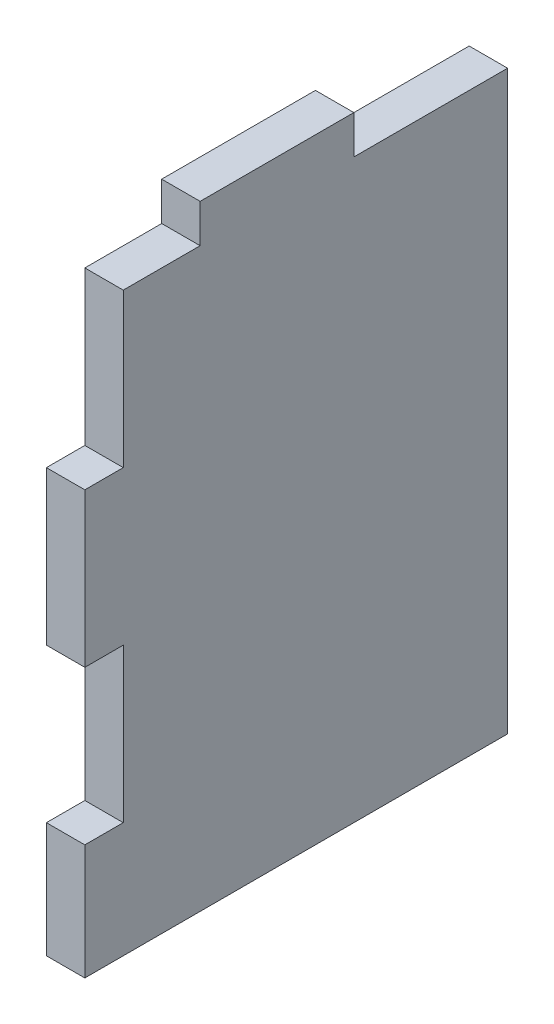
from build123d import *

# Parameters (mm, degrees)
SKETCH1_W           = 31.75
SKETCH1_H           = 47.625
SKETCH1_W_2         = 12.7
SKETCH1_H_2         = 3.175
SKETCH1_W_3         = 3.175
SKETCH1_H_3         = 9.525
SKETCH1_H_4         = 12.7
BOSS_EXTRUDE1_DEPTH = 3.175


with BuildPart() as part:
    # Sketch1 → Boss-Extrude1 (new body)
    with BuildSketch(Plane(origin=(0, 0, 0), x_dir=(0, 0, -1), z_dir=(1, 0, 0))):
        with Locations((15.875, 23.8125)):
            Rectangle(SKETCH1_W, SKETCH1_H)
        with Locations((12.7, 49.2125)):
            Rectangle(SKETCH1_W_2, SKETCH1_H_2)
        with Locations((-1.5875, 4.7625)):
            Rectangle(SKETCH1_W_3, SKETCH1_H_3)
        with Locations((-1.5875, 28.575)):
            Rectangle(SKETCH1_W_3, SKETCH1_H_4)
    extrude(amount=BOSS_EXTRUDE1_DEPTH)


solid = part.part
